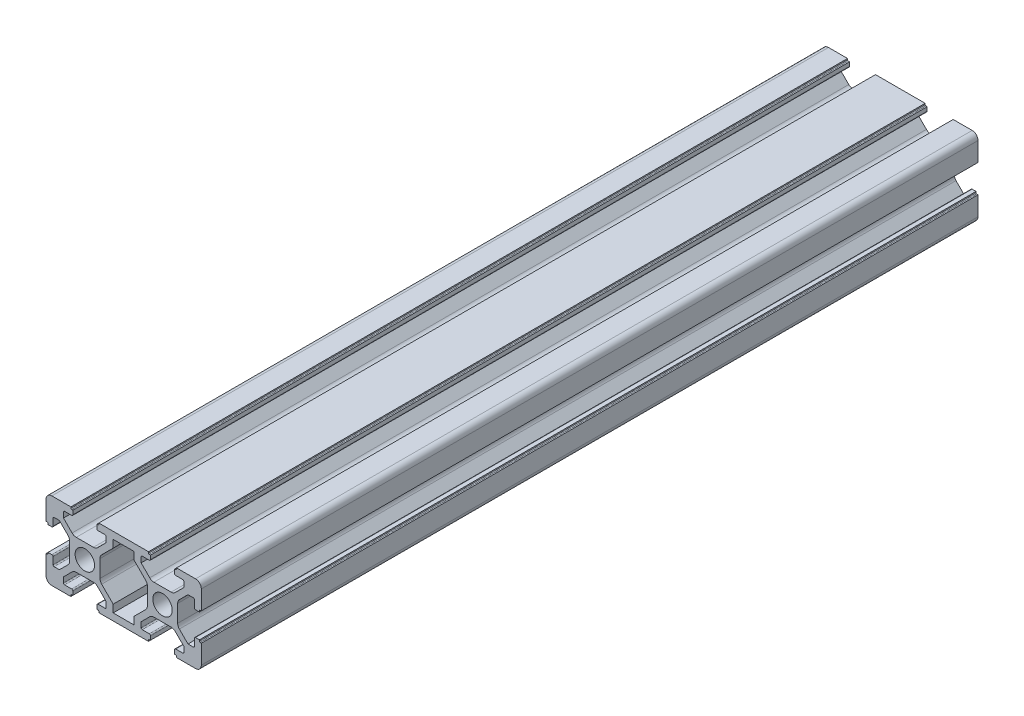
from build123d import *

# Parameters (mm, degrees)
SKETCH_1_R      = 2.5
EXTRUDE_1_DEPTH = 200


with BuildPart() as part:
    # 草图1 → 凸台-拉伸1 (new body)
    with BuildSketch(Plane.XY):
        with BuildLine():
            Line((-0.771587854, 9.545792426), (-5.671587854, 9.545792426))
            Line((-5.671587854, 9.545792426), (-5.671587854, 9.245792426))
            ThreePointArc((-5.671587854, 9.245792426), (-5.730166498, 9.10437107), (-5.871587854, 9.045792426))
            Line((-5.871587854, 9.045792426), (-6.171587854, 9.045792426))
            Line((-6.171587854, 9.045792426), (-6.171587854, 8.045792426))
            ThreePointArc((-6.171587854, 8.045792426), (-6.083719889, 7.833660392), (-5.871587854, 7.745792426))
            Line((-5.871587854, 7.745792426), (-4.071587854, 7.745792426))
            ThreePointArc((-4.071587854, 7.745792426), (-3.85945582, 7.657924461), (-3.771587854, 7.445792426))
            Line((-3.771587854, 7.445792426), (-3.771587854, 6.105792426))
            Line((-3.771587854, 6.105792426), (-5.992248026, 3.885132255))
            ThreePointArc((-5.992248026, 3.885132255), (-6.478883049, 3.559973128), (-7.052908198, 3.445792426))
            Line((-7.052908198, 3.445792426), (-11.490267511, 3.445792426))
            ThreePointArc((-11.490267511, 3.445792426), (-12.064292659, 3.559973128), (-12.550927682, 3.885132255))
            Line((-12.550927682, 3.885132255), (-14.771587854, 6.105792426))
            Line((-14.771587854, 6.105792426), (-14.771587854, 7.445792426))
            ThreePointArc((-14.771587854, 7.445792426), (-14.683719889, 7.657924461), (-14.471587854, 7.745792426))
            Line((-14.471587854, 7.745792426), (-12.671587854, 7.745792426))
            ThreePointArc((-12.671587854, 7.745792426), (-12.45945582, 7.833660392), (-12.371587854, 8.045792426))
            Line((-12.371587854, 8.045792426), (-12.371587854, 9.045792426))
            Line((-12.371587854, 9.045792426), (-12.671587854, 9.045792426))
            ThreePointArc((-12.671587854, 9.045792426), (-12.81300921, 9.10437107), (-12.871587854, 9.245792426))
            Line((-12.871587854, 9.245792426), (-12.871587854, 9.545792426))
            Line((-12.871587854, 9.545792426), (-17.771587854, 9.545792426))
            ThreePointArc((-17.771587854, 9.545792426), (-18.832248026, 9.106452598), (-19.271587854, 8.045792426))
            Line((-19.271587854, 8.045792426), (-19.271587854, 3.145792426))
            Line((-19.271587854, 3.145792426), (-18.971587854, 3.145792426))
            ThreePointArc((-18.971587854, 3.145792426), (-18.830166498, 3.087213783), (-18.771587854, 2.945792426))
            Line((-18.771587854, 2.945792426), (-18.771587854, 2.645792426))
            Line((-18.771587854, 2.645792426), (-17.771587854, 2.645792426))
            ThreePointArc((-17.771587854, 2.645792426), (-17.55945582, 2.733660392), (-17.471587854, 2.945792426))
            Line((-17.471587854, 2.945792426), (-17.471587854, 4.745792426))
            ThreePointArc((-17.471587854, 4.745792426), (-17.383719889, 4.957924461), (-17.171587854, 5.045792426))
            Line((-17.171587854, 5.045792426), (-15.831587854, 5.045792426))
            Line((-15.831587854, 5.045792426), (-13.610927682, 2.825132255))
            ThreePointArc((-13.610927682, 2.825132255), (-13.285768555, 2.338497231), (-13.171587854, 1.764472083))
            Line((-13.171587854, 1.764472083), (-13.171587854, -2.67288723))
            ThreePointArc((-13.171587854, -2.67288723), (-13.285768555, -3.246912379), (-13.610927682, -3.733547402))
            Line((-13.610927682, -3.733547402), (-15.831587854, -5.954207574))
            Line((-15.831587854, -5.954207574), (-17.171587854, -5.954207574))
            ThreePointArc((-17.171587854, -5.954207574), (-17.383719889, -5.866339608), (-17.471587854, -5.654207574))
            Line((-17.471587854, -5.654207574), (-17.471587854, -3.854207574))
            ThreePointArc((-17.471587854, -3.854207574), (-17.55945582, -3.642075539), (-17.771587854, -3.554207574))
            Line((-17.771587854, -3.554207574), (-18.771587854, -3.554207574))
            Line((-18.771587854, -3.554207574), (-18.771587854, -3.854207574))
            ThreePointArc((-18.771587854, -3.854207574), (-18.830166498, -3.99562893), (-18.971587854, -4.054207574))
            Line((-18.971587854, -4.054207574), (-19.271587854, -4.054207574))
            Line((-19.271587854, -4.054207574), (-19.271587854, -8.954207574))
            ThreePointArc((-19.271587854, -8.954207574), (-18.832248026, -10.014867745), (-17.771587854, -10.454207574))
            Line((-17.771587854, -10.454207574), (-12.871587854, -10.454207574))
            Line((-12.871587854, -10.454207574), (-12.871587854, -10.154207574))
            ThreePointArc((-12.871587854, -10.154207574), (-12.81300921, -10.012786217), (-12.671587854, -9.954207574))
            Line((-12.671587854, -9.954207574), (-12.371587854, -9.954207574))
            Line((-12.371587854, -9.954207574), (-12.371587854, -8.954207574))
            ThreePointArc((-12.371587854, -8.954207574), (-12.45945582, -8.742075539), (-12.671587854, -8.654207574))
            Line((-12.671587854, -8.654207574), (-14.471587854, -8.654207574))
            ThreePointArc((-14.471587854, -8.654207574), (-14.683719889, -8.566339608), (-14.771587854, -8.354207574))
            Line((-14.771587854, -8.354207574), (-14.771587854, -7.014207574))
            Line((-14.771587854, -7.014207574), (-12.550927682, -4.793547402))
            ThreePointArc((-12.550927682, -4.793547402), (-12.064292659, -4.468388275), (-11.490267511, -4.354207574))
            Line((-11.490267511, -4.354207574), (-7.052908198, -4.354207574))
            ThreePointArc((-7.052908198, -4.354207574), (-6.478883049, -4.468388275), (-5.992248026, -4.793547402))
            Line((-5.992248026, -4.793547402), (-3.771587854, -7.014207574))
            Line((-3.771587854, -7.014207574), (-3.771587854, -8.354207574))
            ThreePointArc((-3.771587854, -8.354207574), (-3.85945582, -8.566339608), (-4.071587854, -8.654207574))
            Line((-4.071587854, -8.654207574), (-5.871587854, -8.654207574))
            ThreePointArc((-5.871587854, -8.654207574), (-6.083719889, -8.742075539), (-6.171587854, -8.954207574))
            Line((-6.171587854, -8.954207574), (-6.171587854, -9.954207574))
            Line((-6.171587854, -9.954207574), (-5.871587854, -9.954207574))
            ThreePointArc((-5.871587854, -9.954207574), (-5.730166498, -10.012786217), (-5.671587854, -10.154207574))
            Line((-5.671587854, -10.154207574), (-5.671587854, -10.454207574))
            Line((-5.671587854, -10.454207574), (-0.771587854, -10.454207574))
            Line((-0.771587854, -10.454207574), (7.128412146, -10.454207574))
            Line((7.128412146, -10.454207574), (7.128412146, -10.154207574))
            ThreePointArc((7.128412146, -10.154207574), (7.18699079, -10.012786217), (7.328412146, -9.954207574))
            Line((7.328412146, -9.954207574), (7.628412146, -9.954207574))
            Line((7.628412146, -9.954207574), (7.628412146, -8.954207574))
            ThreePointArc((7.628412146, -8.954207574), (7.54054418, -8.742075539), (7.328412146, -8.654207574))
            Line((7.328412146, -8.654207574), (5.528412146, -8.654207574))
            ThreePointArc((5.528412146, -8.654207574), (5.316280111, -8.566339608), (5.228412146, -8.354207574))
            Line((5.228412146, -8.354207574), (5.228412146, -7.014207574))
            Line((5.228412146, -7.014207574), (7.449072318, -4.793547402))
            ThreePointArc((7.449072318, -4.793547402), (7.935707341, -4.468388275), (8.509732489, -4.354207574))
            Line((8.509732489, -4.354207574), (12.947091802, -4.354207574))
            ThreePointArc((12.947091802, -4.354207574), (13.521116951, -4.468388275), (14.007751974, -4.793547402))
            Line((14.007751974, -4.793547402), (16.228412146, -7.014207574))
            Line((16.228412146, -7.014207574), (16.228412146, -8.354207574))
            ThreePointArc((16.228412146, -8.354207574), (16.14054418, -8.566339608), (15.928412146, -8.654207574))
            Line((15.928412146, -8.654207574), (14.128412146, -8.654207574))
            ThreePointArc((14.128412146, -8.654207574), (13.916280111, -8.742075539), (13.828412146, -8.954207574))
            Line((13.828412146, -8.954207574), (13.828412146, -9.954207574))
            Line((13.828412146, -9.954207574), (14.128412146, -9.954207574))
            ThreePointArc((14.128412146, -9.954207574), (14.269833502, -10.012786217), (14.328412146, -10.154207574))
            Line((14.328412146, -10.154207574), (14.328412146, -10.454207574))
            Line((14.328412146, -10.454207574), (19.228412146, -10.454207574))
            ThreePointArc((19.228412146, -10.454207574), (20.289072318, -10.014867745), (20.728412146, -8.954207574))
            Line((20.728412146, -8.954207574), (20.728412146, -4.054207574))
            Line((20.728412146, -4.054207574), (20.428412146, -4.054207574))
            ThreePointArc((20.428412146, -4.054207574), (20.28699079, -3.99562893), (20.228412146, -3.854207574))
            Line((20.228412146, -3.854207574), (20.228412146, -3.554207574))
            Line((20.228412146, -3.554207574), (19.228412146, -3.554207574))
            ThreePointArc((19.228412146, -3.554207574), (19.016280111, -3.642075539), (18.928412146, -3.854207574))
            Line((18.928412146, -3.854207574), (18.928412146, -5.654207574))
            ThreePointArc((18.928412146, -5.654207574), (18.84054418, -5.866339608), (18.628412146, -5.954207574))
            Line((18.628412146, -5.954207574), (17.288412146, -5.954207574))
            Line((17.288412146, -5.954207574), (15.067751974, -3.733547402))
            ThreePointArc((15.067751974, -3.733547402), (14.742592847, -3.246912379), (14.628412146, -2.67288723))
            Line((14.628412146, -2.67288723), (14.628412146, 1.764472083))
            ThreePointArc((14.628412146, 1.764472083), (14.742592847, 2.338497231), (15.067751974, 2.825132255))
            Line((15.067751974, 2.825132255), (17.288412146, 5.045792426))
            Line((17.288412146, 5.045792426), (18.628412146, 5.045792426))
            ThreePointArc((18.628412146, 5.045792426), (18.84054418, 4.957924461), (18.928412146, 4.745792426))
            Line((18.928412146, 4.745792426), (18.928412146, 2.945792426))
            ThreePointArc((18.928412146, 2.945792426), (19.016280111, 2.733660392), (19.228412146, 2.645792426))
            Line((19.228412146, 2.645792426), (20.228412146, 2.645792426))
            Line((20.228412146, 2.645792426), (20.228412146, 2.945792426))
            ThreePointArc((20.228412146, 2.945792426), (20.28699079, 3.087213783), (20.428412146, 3.145792426))
            Line((20.428412146, 3.145792426), (20.728412146, 3.145792426))
            Line((20.728412146, 3.145792426), (20.728412146, 8.045792426))
            ThreePointArc((20.728412146, 8.045792426), (20.289072318, 9.106452598), (19.228412146, 9.545792426))
            Line((19.228412146, 9.545792426), (14.328412146, 9.545792426))
            Line((14.328412146, 9.545792426), (14.328412146, 9.245792426))
            ThreePointArc((14.328412146, 9.245792426), (14.269833502, 9.10437107), (14.128412146, 9.045792426))
            Line((14.128412146, 9.045792426), (13.828412146, 9.045792426))
            Line((13.828412146, 9.045792426), (13.828412146, 8.045792426))
            ThreePointArc((13.828412146, 8.045792426), (13.916280111, 7.833660392), (14.128412146, 7.745792426))
            Line((14.128412146, 7.745792426), (15.928412146, 7.745792426))
            ThreePointArc((15.928412146, 7.745792426), (16.14054418, 7.657924461), (16.228412146, 7.445792426))
            Line((16.228412146, 7.445792426), (16.228412146, 6.105792426))
            Line((16.228412146, 6.105792426), (14.007751974, 3.885132255))
            ThreePointArc((14.007751974, 3.885132255), (13.521116951, 3.559973128), (12.947091802, 3.445792426))
            Line((12.947091802, 3.445792426), (8.509732489, 3.445792426))
            ThreePointArc((8.509732489, 3.445792426), (7.935707341, 3.559973128), (7.449072318, 3.885132255))
            Line((7.449072318, 3.885132255), (5.228412146, 6.105792426))
            Line((5.228412146, 6.105792426), (5.228412146, 7.445792426))
            ThreePointArc((5.228412146, 7.445792426), (5.316280111, 7.657924461), (5.528412146, 7.745792426))
            Line((5.528412146, 7.745792426), (7.328412146, 7.745792426))
            ThreePointArc((7.328412146, 7.745792426), (7.54054418, 7.833660392), (7.628412146, 8.045792426))
            Line((7.628412146, 8.045792426), (7.628412146, 9.045792426))
            Line((7.628412146, 9.045792426), (7.328412146, 9.045792426))
            ThreePointArc((7.328412146, 9.045792426), (7.18699079, 9.10437107), (7.128412146, 9.245792426))
            Line((7.128412146, 9.245792426), (7.128412146, 9.545792426))
            Line((7.128412146, 9.545792426), (2.228412146, 9.545792426))
            Line((2.228412146, 9.545792426), (-0.771587854, 9.545792426))
        make_face()
        with Locations((10.728412146, -0.454207574)):
            Circle(SKETCH_1_R, mode=Mode.SUBTRACT)
        with Locations((-9.271587854, -0.454207574)):
            Circle(SKETCH_1_R, mode=Mode.SUBTRACT)
        with BuildLine():
            Line((-1.971587854, -6.694207574), (-4.932248026, -3.733547402))
            ThreePointArc((-4.932248026, -3.733547402), (-5.257407153, -3.246912379), (-5.371587854, -2.67288723))
            Line((-5.371587854, -2.67288723), (-5.371587854, 1.764472083))
            ThreePointArc((-5.371587854, 1.764472083), (-5.257407153, 2.338497231), (-4.932248026, 2.825132255))
            Line((-4.932248026, 2.825132255), (-1.971587854, 5.785792426))
            Line((-1.971587854, 5.785792426), (-1.971587854, 7.745792426))
            Line((-1.971587854, 7.745792426), (3.428412146, 7.745792426))
            Line((3.428412146, 7.745792426), (3.428412146, 5.785792426))
            Line((3.428412146, 5.785792426), (6.389072318, 2.825132255))
            ThreePointArc((6.389072318, 2.825132255), (6.714231445, 2.338497231), (6.828412146, 1.764472083))
            Line((6.828412146, 1.764472083), (6.828412146, -2.67288723))
            ThreePointArc((6.828412146, -2.67288723), (6.714231445, -3.246912379), (6.389072318, -3.733547402))
            Line((6.389072318, -3.733547402), (3.428412146, -6.694207574))
            Line((3.428412146, -6.694207574), (3.428412146, -8.654207574))
            Line((3.428412146, -8.654207574), (-1.971587854, -8.654207574))
            Line((-1.971587854, -8.654207574), (-1.971587854, -6.694207574))
        make_face(mode=Mode.SUBTRACT)
    extrude(amount=EXTRUDE_1_DEPTH)


solid = part.part
